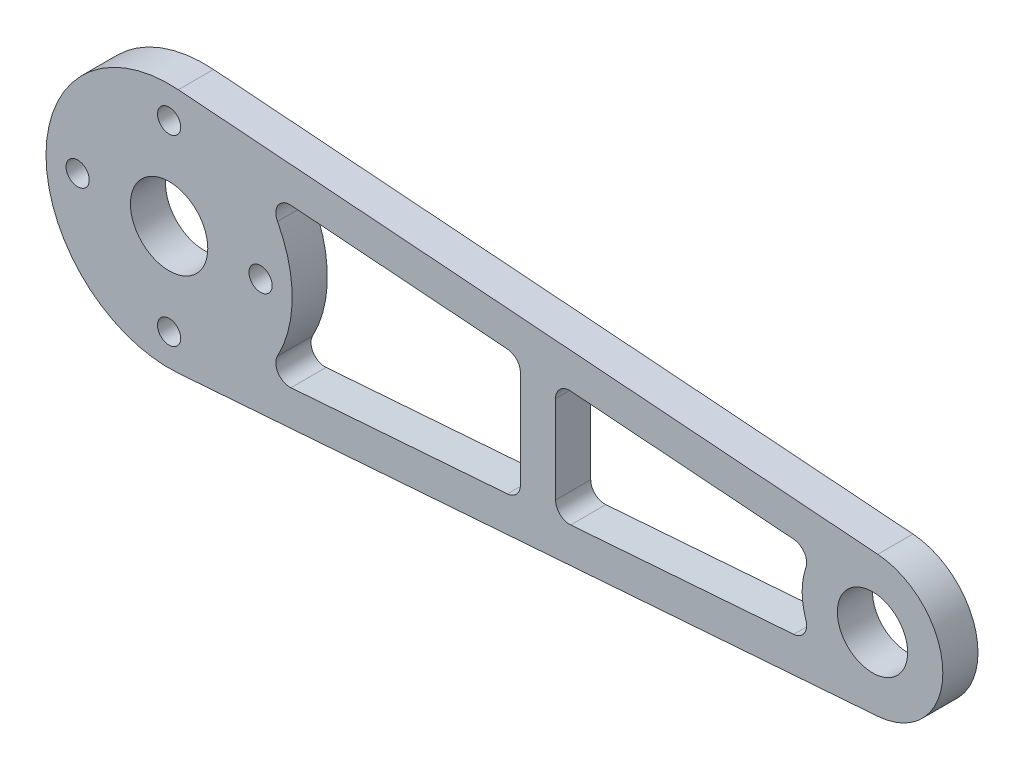
from build123d import *

# Parameters (mm, degrees)
SKETCH_2_R      = 5.5
SKETCH_2_R_2    = 5
SKETCH_2_R_3    = 1.65
EXTRUDE_1_DEPTH = 5


with BuildPart() as part:
    # 草图2 → 凸台-拉伸1 (new body)
    with BuildSketch(Plane.XY):
        with BuildLine():
            Line((1.3125, 17.450711841), (100.75, 9.971835338))
            ThreePointArc((100.75, 9.971835338), (110, 0), (100.75, -9.971835338))
            Line((100.75, -9.971835338), (1.3125, -17.450711841))
            ThreePointArc((1.3125, -17.450711841), (-17.5, 0), (1.3125, 17.450711841))
        make_face()
        Circle(SKETCH_2_R, mode=Mode.SUBTRACT)
        with Locations((100, 0)):
            Circle(SKETCH_2_R_2, mode=Mode.SUBTRACT)
        with Locations((0, 13)):
            Circle(SKETCH_2_R_3, mode=Mode.SUBTRACT)
        with Locations((13, 0)):
            Circle(SKETCH_2_R_3, mode=Mode.SUBTRACT)
        with Locations((0, -13)):
            Circle(SKETCH_2_R_3, mode=Mode.SUBTRACT)
        with Locations((-13, 0)):
            Circle(SKETCH_2_R_3, mode=Mode.SUBTRACT)
        with BuildLine():
            Line((17.322897462, -11.232418418), (48.094795732, -8.918007587))
            ThreePointArc((48.094795732, -8.918007587), (49.411083562, -8.283787571), (49.944795732, -6.92364052))
            Line((49.944795732, -6.92364052), (49.944795732, 6.92364052))
            ThreePointArc((49.944795732, 6.92364052), (49.411083562, 8.283787571), (48.094795732, 8.918007587))
            Line((48.094795732, 8.918007587), (17.322897462, 11.232418418))
            ThreePointArc((17.322897462, 11.232418418), (15.495779502, 10.327673003), (15.411574646, 8.290558904))
            ThreePointArc((15.411574646, 8.290558904), (17.5, 0), (15.411574646, -8.290558904))
            ThreePointArc((15.411574646, -8.290558904), (15.495779502, -10.327673003), (17.322897462, -11.232418418))
        make_face(mode=Mode.SUBTRACT)
        with BuildLine():
            Line((57.094795732, 8.241101103), (88.788774342, 5.857338922))
            ThreePointArc((88.788774342, 5.857338922), (90.307315813, 4.965681861), (90.532311952, 3.219143212))
            ThreePointArc((90.532311952, 3.219143212), (90, 0), (90.532311952, -3.219143212))
            ThreePointArc((90.532311952, -3.219143212), (90.307315813, -4.965681861), (88.788774342, -5.857338922))
            Line((88.788774342, -5.857338922), (57.094795732, -8.241101103))
            ThreePointArc((57.094795732, -8.241101103), (55.584648681, -7.713021866), (54.944795732, -6.246734036))
            Line((54.944795732, -6.246734036), (54.944795732, 6.246734036))
            ThreePointArc((54.944795732, 6.246734036), (55.584648681, 7.713021866), (57.094795732, 8.241101103))
        make_face(mode=Mode.SUBTRACT)
    extrude(amount=EXTRUDE_1_DEPTH)


solid = part.part
